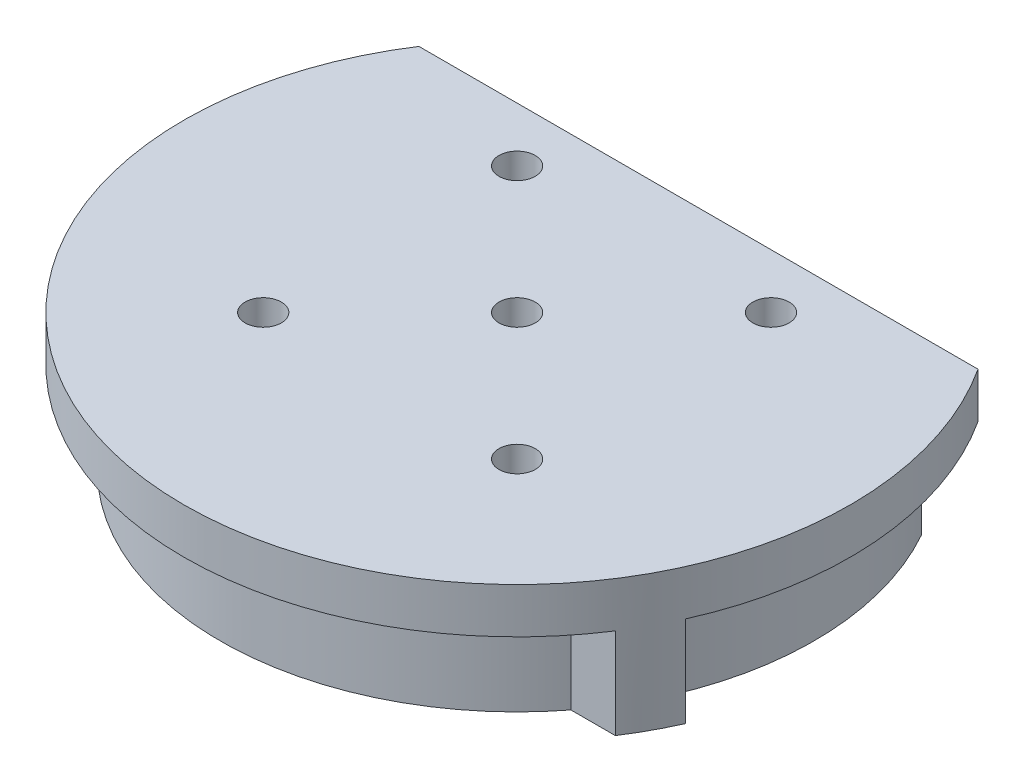
from build123d import *

# Parameters (mm, degrees)
CYLINDER_DEPTH      = 5
CYLINDER_DEPTH_BACK = 10
SKETCH_1_R          = 7.5
SKETCH_1_R_2        = 2
SKETCH_2_R          = 36.75
SKETCH_2_R_2        = 2.5
BASE_HORIZONT_DEPTH = 5
SKETCH_3_R          = 32.75
SKETCH_3_R_2        = 28.75
EDGE_2_DEPTH        = 15
CUTOFF_DEPTH        = 10
CUTOFF_DEPTH_BACK   = 10
SKETCH_8_W          = 61.662387238
SKETCH_8_H          = 16.75
SKETCH_12_W         = 8
SKETCH_12_H         = 4
CUT_EXTRUDE_1_DEPTH = 10
EXTRUDE_2_DEPTH     = 10
SKETCH_14_R         = 2
CUT_EXTRUDE_3_DEPTH = 10


with BuildPart() as part:
    # Эскиз1 → cylinder (new, two sides: drawn at the far end of the back side and taken through both)
    with BuildSketch(Plane(origin=(0, 0, 0), x_dir=(1, 0, 0), z_dir=(0, 1, 0)).offset(-CYLINDER_DEPTH_BACK)):
        with Locations(Location((0, 0, 0), (0, 0, 270))):
            Circle(SKETCH_1_R)
        with Locations(Location((0, 0, 0), (0, 0, 270))):
            Circle(SKETCH_1_R_2, mode=Mode.SUBTRACT)
    extrude(amount=CYLINDER_DEPTH + CYLINDER_DEPTH_BACK)

    # Эскиз2 → base horizont (add)
    with BuildSketch(Plane(origin=(0, 0, 0), x_dir=(1, 0, 0), z_dir=(0, 1, 0))):
        with Locations(Location((0, 0, 0), (0, 0, 270))):
            Circle(SKETCH_2_R)
        Circle(SKETCH_2_R_2, mode=Mode.SUBTRACT)
    extrude(amount=BASE_HORIZONT_DEPTH)

    # Эскиз3 → edge 2 (add)
    with BuildSketch(Plane(origin=(0, 5, 0), x_dir=(1, 0, 0), z_dir=(0, 1, 0))):
        with Locations(Location((0, 0, 0), (0, 0, 270))):
            Circle(SKETCH_3_R)
        with Locations(Location((0, 0, 0), (0, 0, 270))):
            Circle(SKETCH_3_R_2, mode=Mode.SUBTRACT)
    extrude(amount=-EDGE_2_DEPTH)

    # Эскиз8 → cutoff (cut, two sides: drawn at the far end of the back side and taken through both)
    with BuildSketch(Plane(origin=(0, 0, 0), x_dir=(1, 0, 0), z_dir=(0, 1, 0)).offset(-CUTOFF_DEPTH_BACK)):
        with Locations((0, 28.375)):
            Rectangle(SKETCH_8_W, SKETCH_8_H)
    extrude(amount=CUTOFF_DEPTH + CUTOFF_DEPTH_BACK, mode=Mode.SUBTRACT)

    # Эскиз12 → Вытянуть1 (cut)
    with BuildSketch(Plane.XZ.offset(10)):
        with Locations((-24.575557737, -18)):
            Rectangle(SKETCH_12_W, SKETCH_12_H)
        with Locations((24.575557737, -18)):
            Rectangle(SKETCH_12_W, SKETCH_12_H)
    extrude(amount=-CUT_EXTRUDE_1_DEPTH, mode=Mode.SUBTRACT)

    # Эскиз13 → Вытянуть2 (add)
    with BuildSketch(Plane.XZ):
        with BuildLine():
            Line((-30.831193619, 20), (-25.933809978, 20))
            ThreePointArc((-25.933809978, 20), (-27.636674985, 17.572043016), (-29.112926682, 15))
            Line((-29.112926682, 15), (-33.54940387, 15))
            ThreePointArc((-33.54940387, 15), (-32.287231737, 17.552696851), (-30.831193619, 20))
        make_face()
        with BuildLine():
            Line((33.54940387, 15), (29.112926682, 15))
            ThreePointArc((29.112926682, 15), (27.636674985, 17.572043016), (25.933809978, 20))
            Line((25.933809978, 20), (30.831193619, 20))
            ThreePointArc((30.831193619, 20), (32.287231737, 17.552696851), (33.54940387, 15))
        make_face()
    extrude(amount=EXTRUDE_2_DEPTH)

    # Эскиз14 → Вытянуть3 (cut)
    with BuildSketch(Plane(origin=(0, 5, 0), x_dir=(1, 0, 0), z_dir=(0, 1, 0))):
        with Locations(Location((14, -14, 0), (0, 0, 270))):
            Circle(SKETCH_14_R)
        with Locations(Location((-14, -14, 0), (0, 0, 270))):
            Circle(SKETCH_14_R)
        with Locations(Location((-14, 14, 0), (0, 0, 270))):
            Circle(SKETCH_14_R)
        with Locations(Location((14, 14, 0), (0, 0, 270))):
            Circle(SKETCH_14_R)
    extrude(amount=-CUT_EXTRUDE_3_DEPTH, mode=Mode.SUBTRACT)


solid = part.part
